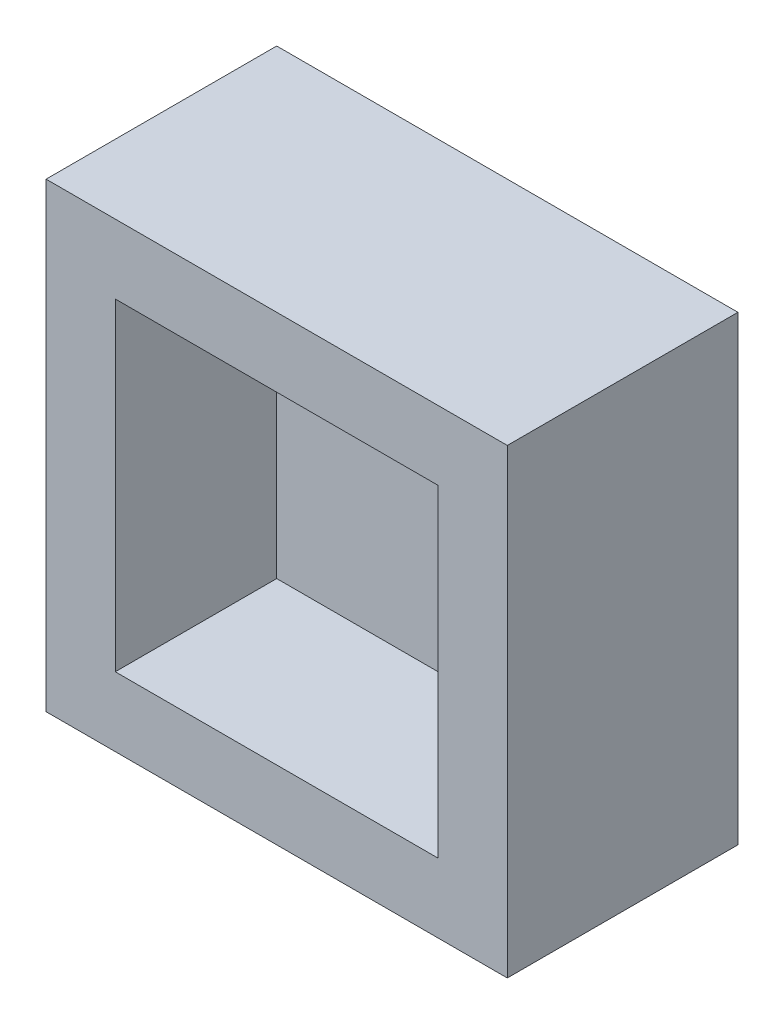
from build123d import *

# Parameters (mm, degrees)
SKETCH_1_W    = 20
SKETCH_1_H    = 20
BASEBOX_DEPTH = 10
SHELL_T       = -3


with BuildPart() as part:
    # 草图1 → BaseBox (new body)
    with BuildSketch(Plane.XY):
        with Locations((10, 10)):
            Rectangle(SKETCH_1_W, SKETCH_1_H)
    extrude(amount=BASEBOX_DEPTH)

    # Shell
    shell_openings = [part.faces().sort_by_distance(p)[0] for p in [
        (10, 10, 10),
    ]]
    offset(amount=SHELL_T, openings=shell_openings, kind=Kind.INTERSECTION)


solid = part.part
